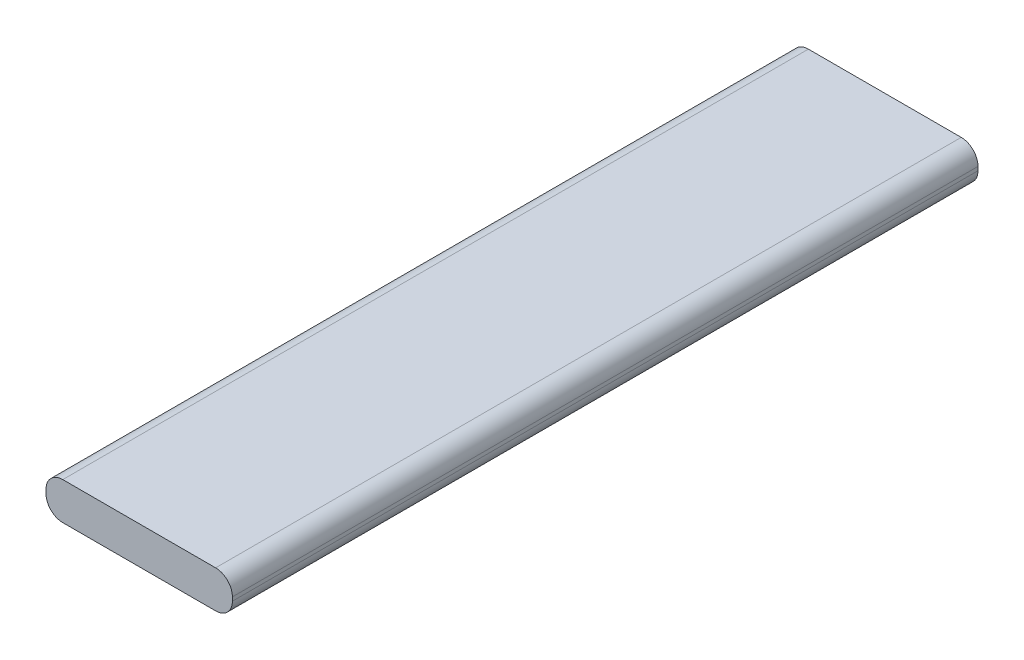
from build123d import *

# Parameters (mm, degrees)
BOSS_EXTRUDE1_DEPTH = 20


with BuildPart() as part:
    # Sketch1 → Boss-Extrude1 (new body)
    with BuildSketch(Plane.XY):
        with BuildLine():
            Line((-2.05, 0.5), (2.05, 0.5))
            ThreePointArc((2.05, 0.5), (2.368198052, 0.368198052), (2.5, 0.05))
            Line((2.5, 0.05), (2.5, -0.05))
            ThreePointArc((2.5, -0.05), (2.368198052, -0.368198052), (2.05, -0.5))
            Line((2.05, -0.5), (-2.05, -0.5))
            ThreePointArc((-2.05, -0.5), (-2.368198052, -0.368198052), (-2.5, -0.05))
            Line((-2.5, -0.05), (-2.5, 0.05))
            ThreePointArc((-2.5, 0.05), (-2.368198052, 0.368198052), (-2.05, 0.5))
        make_face()
    extrude(amount=BOSS_EXTRUDE1_DEPTH)


solid = part.part
